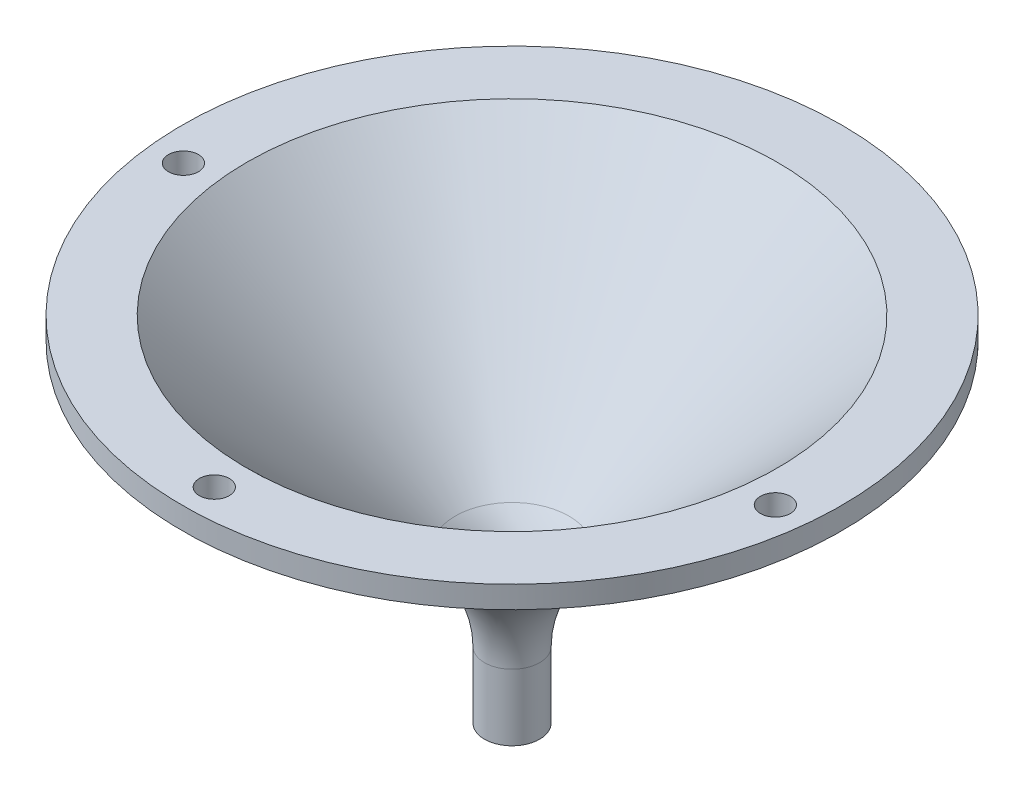
from build123d import *

# Parameters (mm, degrees)
ESQUISSE3_R             = 2.15
ENL_V_MAT_EXTRU_1_DEPTH = 85.070480268
ESQUISSE4_W             = 1.2
ESQUISSE4_H             = 7.846267026
BOSS_EXTRU_1_DEPTH      = 6.35


with BuildPart() as part:
    # Esquisse1 → Révolution1 (revolve)
    with BuildSketch(Plane.XY):
        with BuildLine():
            Line((3.96875, 0), (3.96875, 9.534696006))
            ThreePointArc((3.96875, 9.534696006), (5.270377511, 15.960075858), (8.970022713, 21.372318074))
            Line((8.970022713, 21.372318074), (39.238684771, 50.8))
            Line((39.238684771, 50.8), (38.1, 50.8))
            Line((38.1, 50.8), (8.176272713, 21.707669228))
            ThreePointArc((8.176272713, 21.707669228), (4.476627511, 16.295427012), (3.175, 9.87004716))
            Line((3.175, 9.87004716), (3.175, 0))
            Line((3.175, 0), (3.96875, 0))
        make_face()
    revolve(axis=Axis((0, 0, 0), (0, 1, 0)))

    # Esquisse2 → Révolution2 (revolve)
    with BuildSketch(Plane.XY, mode=Mode.PRIVATE) as r_volution2_sk:
        Polygon((39.238684771, 50.8), (47.366684771, 50.8), (47.366684771, 47.625), (35.97295007, 47.625), align=None)
    revolve(r_volution2_sk.sketch.rotate(Axis((0, 0, 0), (0, 1, 0)), 180), axis=Axis((0, 0, 0), (0, 1, 0)))

    # Esquisse3 → Enlèv. mat.-Extru.1 (cut, through all)
    with BuildSketch(Plane(origin=(0, 50.8, 0), x_dir=(1, 0, 0), z_dir=(0, 1, 0))):
        with Locations(Location((0, -42.794684771, 0), (0, 0, 180))):
            Circle(ESQUISSE3_R)
        with Locations(Location((-42.53639594, -4.694684771, 0), (0, 0, 180))):
            Circle(ESQUISSE3_R)
        with Locations(Location((42.53639594, -4.694684771, 0), (0, 0, 180))):
            Circle(ESQUISSE3_R)
    extrude(amount=-ENL_V_MAT_EXTRU_1_DEPTH, mode=Mode.SUBTRACT)

    # Esquisse4 → Boss.-Extru.1 (add)
    with BuildSketch(Plane.XZ):
        Rectangle(ESQUISSE4_W, ESQUISSE4_H)
    extrude(amount=-BOSS_EXTRU_1_DEPTH)


solid = part.part
